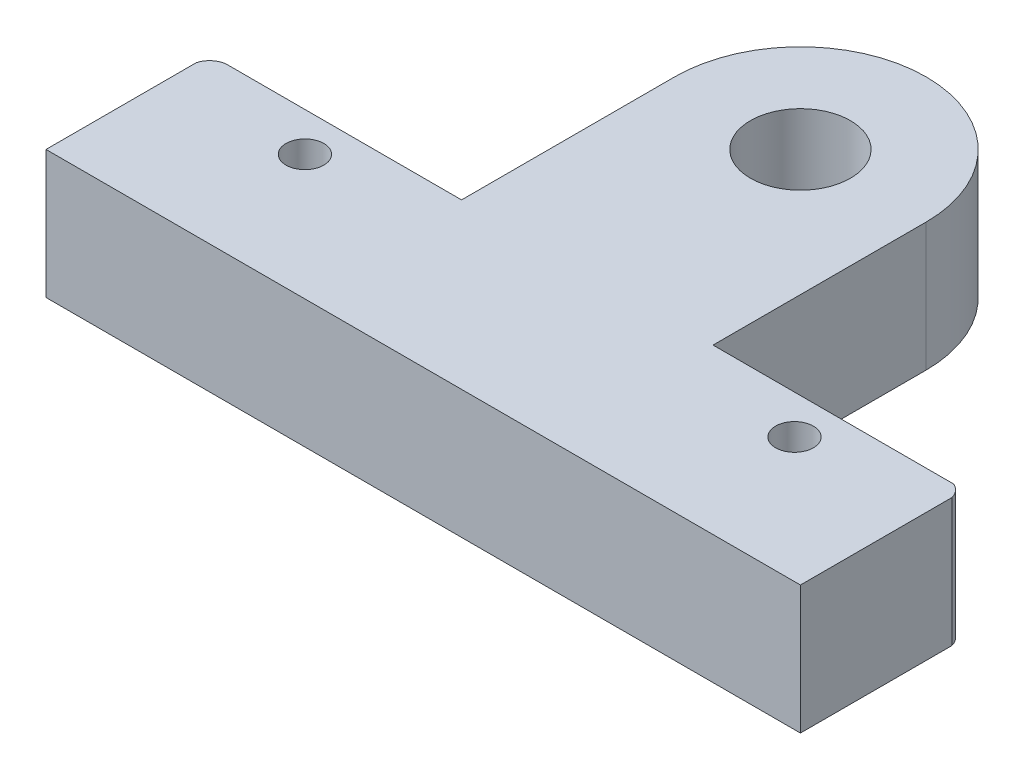
from build123d import *

# Parameters (mm, degrees)
CROQUIS1_R              = 3.975
CROQUIS1_R_2            = 1.5
SALIENTE_EXTRUIR1_DEPTH = 10.2


with BuildPart() as part:
    # Croquis1 → Saliente-Extruir1 (new body)
    with BuildSketch(Plane(origin=(0, 0, 0), x_dir=(1, 0, 0), z_dir=(0, 1, 0))):
        with BuildLine():
            Line((-34.10243875, 6.486534721), (-15.364079564, 6.486534721))
            Line((-15.364079564, 6.486534721), (-15.364079564, 23.436691068))
            ThreePointArc((-15.364079564, 23.436691068), (-5.364079564, 33.436691068), (4.635920436, 23.436691068))
            Line((4.635920436, 23.436691068), (4.635920436, 6.486534721))
            Line((4.635920436, 6.486534721), (23.768585867, 6.486534721))
            ThreePointArc((23.768585867, 6.486534721), (24.318891967, 6.08655714), (24.635920436, 5.484633707))
            Line((24.635920436, 5.484633707), (24.635920436, -6.563308932))
            Line((24.635920436, -6.563308932), (-35.364079564, -6.563308932))
            Line((-35.364079564, -6.563308932), (-35.364079564, 5.386400848))
            ThreePointArc((-35.364079564, 5.386400848), (-34.900990267, 6.128822933), (-34.10243875, 6.486534721))
        make_face()
        with Locations(Location((-5.364079564, 23.436691068, 0), (0, 0, 270))):
            Circle(CROQUIS1_R, mode=Mode.SUBTRACT)
        with Locations(Location((-24.733259157, 3.398021726, 0), (0, 0, 270))):
            Circle(CROQUIS1_R_2, mode=Mode.SUBTRACT)
        with Locations(Location((14.202253152, 3.398021726, 0), (0, 0, 270))):
            Circle(CROQUIS1_R_2, mode=Mode.SUBTRACT)
    extrude(amount=SALIENTE_EXTRUIR1_DEPTH)


solid = part.part
